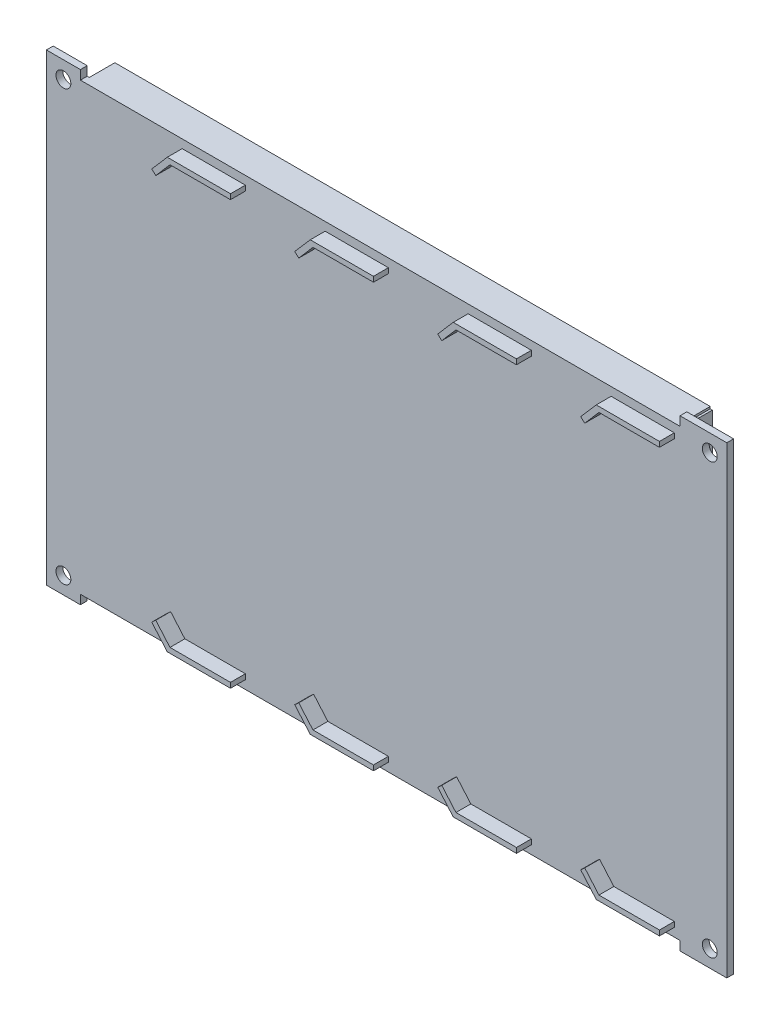
from build123d import *

# Parameters (mm, degrees)
SKETCH_1_W          = 160
SKETCH_1_H          = 109
EXTRUDE_1_DEPTH     = 1.6
SKETCH_2_R          = 1.75
CUT_EXTRUDE_1_DEPTH = 2
SKETCH_4_W          = 141
SKETCH_4_H          = 104.7
EXTRUDE_2_DEPTH     = 6
SKETCH_13_W         = 141
SKETCH_13_H         = 2.15
CUT_EXTRUDE_4_DEPTH = 10
CUT_EXTRUDE_2_DEPTH = 1
SKETCH_6_W          = 0.5
SKETCH_6_H          = 0.5
CUT_EXTRUDE_3_DEPTH = 6
EXTRUDE_5_DEPTH     = 3.5
EXTRUDE_6_DEPTH     = 3.5


with BuildPart() as part:
    # 草图1 → 拉伸1 (new body)
    with BuildSketch(Plane.XY):
        Rectangle(SKETCH_1_W, SKETCH_1_H)
    extrude(amount=EXTRUDE_1_DEPTH)

    # 草图2 → 切除-拉伸1 (cut)
    with BuildSketch(Plane(origin=(0, 0, 0), x_dir=(-1, 0, 0), z_dir=(0, 0, -1))):
        with Locations((-76, 50.5)):
            Circle(SKETCH_2_R)
        with Locations((76, 50.5)):
            Circle(SKETCH_2_R)
        with Locations(Location((76, -50.5, 0), (0, 0, 180))):
            Circle(SKETCH_2_R)
        with Locations(Location((-76, -50.5, 0), (0, 0, 180))):
            Circle(SKETCH_2_R)
    extrude(amount=-CUT_EXTRUDE_1_DEPTH, mode=Mode.SUBTRACT)

    # 草图4 → 拉伸2 (add)
    with BuildSketch(Plane(origin=(0, 0, 0), x_dir=(-1, 0, 0), z_dir=(0, 0, -1))):
        with Locations((1.5, 0)):
            Rectangle(SKETCH_4_W, SKETCH_4_H)
    extrude(amount=EXTRUDE_2_DEPTH)

    # 草图13 → 切除-拉伸4 (cut)
    with BuildSketch(Plane(origin=(0, 0, 0), x_dir=(-1, 0, 0), z_dir=(0, 0, -1))):
        with Locations((1.5, 53.425)):
            Rectangle(SKETCH_13_W, SKETCH_13_H)
        with Locations((1.5, -53.425)):
            Rectangle(SKETCH_13_W, SKETCH_13_H)
    extrude(amount=-CUT_EXTRUDE_4_DEPTH, mode=Mode.SUBTRACT)

    # 草图5 → 切除-拉伸2 (cut)
    with BuildSketch(Plane(origin=(0, 0, -6), x_dir=(-1, 0, 0), z_dir=(0, 0, -1))):
        with BuildLine():
            Line((-54.5, 45.95), (66.5, 45.95))
            ThreePointArc((66.5, 45.95), (66.853553391, 45.803553391), (67, 45.45))
            Line((67, 45.45), (67, -45.55))
            ThreePointArc((67, -45.55), (66.853553391, -45.903553391), (66.5, -46.05))
            Line((66.5, -46.05), (-54.5, -46.05))
            ThreePointArc((-54.5, -46.05), (-54.853553391, -45.903553391), (-55, -45.55))
            Line((-55, -45.55), (-55, 45.45))
            ThreePointArc((-55, 45.45), (-54.853553391, 45.803553391), (-54.5, 45.95))
        make_face()
    extrude(amount=-CUT_EXTRUDE_2_DEPTH, mode=Mode.SUBTRACT)

    # 草图6 → 切除-拉伸3 (cut)
    with BuildSketch(Plane(origin=(0, 0, -6), x_dir=(-1, 0, 0), z_dir=(0, 0, -1))):
        with Locations((71.75, 52.1)):
            Rectangle(SKETCH_6_W, SKETCH_6_H)
        with Locations((71.75, -52.1)):
            Rectangle(SKETCH_6_W, SKETCH_6_H)
        with Locations((-68.75, -52.1)):
            Rectangle(SKETCH_6_W, SKETCH_6_H)
        with Locations((-68.75, 52.1)):
            Rectangle(SKETCH_6_W, SKETCH_6_H)
    extrude(amount=-CUT_EXTRUDE_3_DEPTH, mode=Mode.SUBTRACT)

    # 草图10 → 拉伸5 (add)
    with BuildSketch(Plane.XY.offset(1.6)):
        Polygon((67.662920389, -50.358827106), (52.793740241, -50.358827106), (49.146582846, -46.150568574), (50.094290582, -45.280392178), (53.430626839, -49.147509203), (67.662920389, -49.147509203), align=None)
        Polygon((34.038890847, -50.358827106), (19.169710699, -50.358827106), (15.522553304, -46.150568574), (16.470261039, -45.280392178), (19.806597297, -49.147509203), (34.038890847, -49.147509203), align=None)
        Polygon((0.414861305, -50.358827106), (-14.454318843, -50.358827106), (-18.101476238, -46.150568574), (-17.153768503, -45.280392178), (-13.817432245, -49.147509203), (0.414861305, -49.147509203), align=None)
        Polygon((-33.209168237, -50.358827106), (-48.078348385, -50.358827106), (-51.72550578, -46.150568574), (-50.777798045, -45.280392178), (-47.441461787, -49.147509203), (-33.209168237, -49.147509203), align=None)
        Polygon((-50.777798045, 45.280392178), (-51.72550578, 46.150568574), (-48.078348385, 50.358827106), (-33.209168237, 50.358827106), (-33.209168237, 49.147509203), (-47.441461787, 49.147509203), align=None)
        Polygon((-17.153768503, 45.280392178), (-18.101476238, 46.150568574), (-14.454318843, 50.358827106), (0.414861305, 50.358827106), (0.414861305, 49.147509203), (-13.817432245, 49.147509203), align=None)
        Polygon((16.470261039, 45.280392178), (15.522553304, 46.150568574), (19.169710699, 50.358827106), (34.038890847, 50.358827106), (34.038890847, 49.147509203), (19.806597297, 49.147509203), align=None)
        Polygon((67.662920389, 50.358827106), (67.662920389, 49.147509203), (53.430626839, 49.147509203), (50.094290582, 45.280392178), (49.146582846, 46.150568574), (52.793740241, 50.358827106), align=None)
    extrude(amount=EXTRUDE_5_DEPTH)

    # 草图12 → 拉伸6 (add)
    with BuildSketch(Plane(origin=(0, 0, 0), x_dir=(-1, 0, 0), z_dir=(0, 0, -1))):
        Polygon((79.4, 40), (79.4, -40), (72, -45.5), (72, 45.5), align=None)
    extrude(amount=EXTRUDE_6_DEPTH)


solid = part.part
